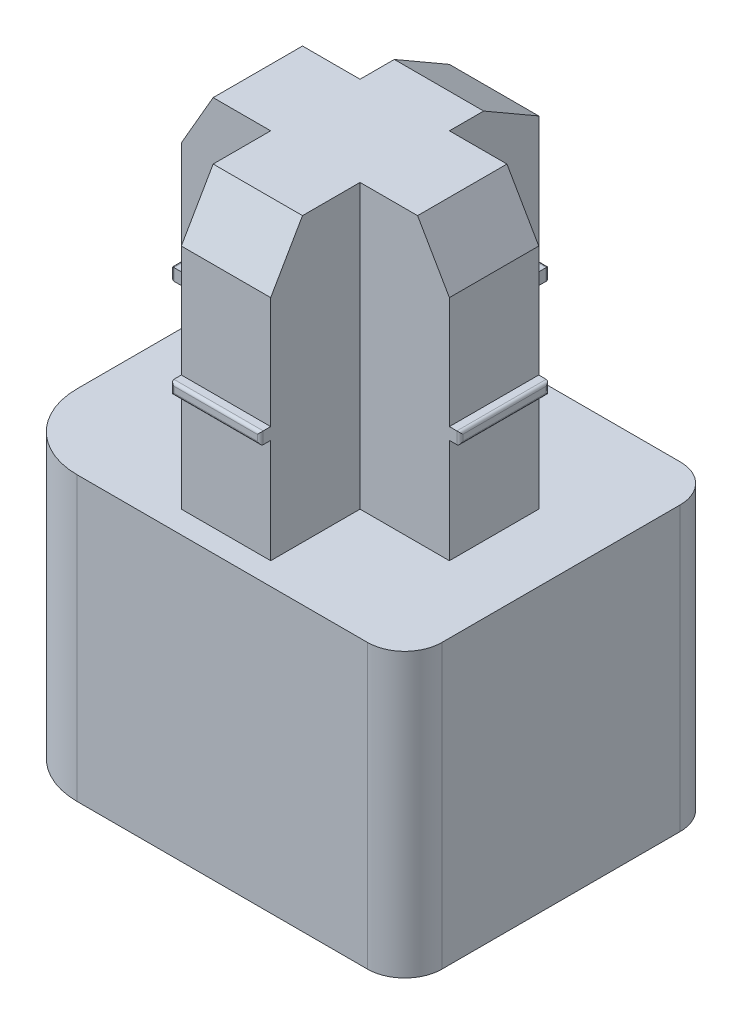
from build123d import *
from OCP.BRepFilletAPI import BRepFilletAPI_MakeChamfer

# Parameters (mm, degrees)
SKETCH1_W           = 6.858
SKETCH1_H           = 5.334
BOSS_EXTRUDE1_DEPTH = 4.826
SKETCH2_W           = 1.524
SKETCH2_H           = 1.524
BOSS_EXTRUDE2_DEPTH = 4.826
CHAMFER1_SIZE       = 0.9398
CHAMFER1_SIZE2      = 0.542593783
BOSS_EXTRUDE3_START = -3.048
SKETCH3_W           = 0.720393783
SKETCH3_H           = 1.524
SKETCH3_W_2         = 0.981406217
SKETCH3_W_3         = 1.524
SKETCH3_H_2         = 1.1176
SKETCH3_H_3         = 0.5842
SKETCH3_H_4         = 0.981406217
SKETCH3_H_5         = 0.720393783
BOSS_EXTRUDE3_DEPTH = 0.2032
FILLET2_R           = 0.0508
FILLET3_R           = 0.635
FILLET6_R           = 1.27
SKETCH4_W           = 3.2766
SKETCH4_H           = 3.2258
CUT_EXTRUDE1_DEPTH  = 2.032


with BuildPart() as part:
    # Sketch1 → Boss-Extrude1 (new body)
    with BuildSketch(Plane(origin=(0, 0, 0), x_dir=(1, 0, 0), z_dir=(0, 1, 0))):
        Rectangle(SKETCH1_W, SKETCH1_H)
    extrude(amount=BOSS_EXTRUDE1_DEPTH)

    # Sketch2 → Boss-Extrude2 (add)
    with BuildSketch(Plane(origin=(0, 4.826, 0), x_dir=(1, 0, 0), z_dir=(0, 1, 0))):
        Rectangle(SKETCH2_W, SKETCH2_H)
        with Locations((1.524, 0)):
            Rectangle(SKETCH2_W, SKETCH2_H)
        with Locations((0, 1.524)):
            Rectangle(SKETCH2_W, SKETCH2_H)
        with Locations((-1.524, 0)):
            Rectangle(SKETCH2_W, SKETCH2_H)
        with Locations((0, -1.524)):
            Rectangle(SKETCH2_W, SKETCH2_H)
    extrude(amount=BOSS_EXTRUDE2_DEPTH)

    # Chamfer1: one chamfer whose edges measure the first distance from different faces: ONE call of the kernel's chamfer builder (chamfer() names one face for all edges)
    chamfer1_edges_1 = [part.edges().sort_by_distance(p)[0] for p in [
        (2.286, 9.652, 0),
    ]]
    chamfer1_side_1 = [part.faces().sort_by_distance(p)[0] for p in [
        (2.286, 7.239, 0),
    ]]
    chamfer1_edges_2 = [part.edges().sort_by_distance(p)[0] for p in [
        (0, 9.652, -2.286),
    ]]
    chamfer1_side_2 = [part.faces().sort_by_distance(p)[0] for p in [
        (0, 9.652, 0),
    ]]
    chamfer1_edges_3 = [part.edges().sort_by_distance(p)[0] for p in [
        (-2.286, 9.652, 0),
    ]]
    chamfer1_side_3 = [part.faces().sort_by_distance(p)[0] for p in [
        (-2.286, 7.239, 0),
    ]]
    chamfer1_edges_4 = [part.edges().sort_by_distance(p)[0] for p in [
        (0, 9.652, 2.286),
    ]]
    chamfer1_side_4 = [part.faces().sort_by_distance(p)[0] for p in [
        (0, 7.239, 2.286),
    ]]
    chamfer1 = BRepFilletAPI_MakeChamfer(part.part.solid().wrapped)
    for e in chamfer1_edges_1:
        chamfer1.Add(CHAMFER1_SIZE, CHAMFER1_SIZE2, e.wrapped, chamfer1_side_1[0].wrapped)  # the first distance lies on this face
    for e in chamfer1_edges_2:
        chamfer1.Add(CHAMFER1_SIZE, CHAMFER1_SIZE2, e.wrapped, chamfer1_side_2[0].wrapped)  # the first distance lies on this face
    for e in chamfer1_edges_3:
        chamfer1.Add(CHAMFER1_SIZE, CHAMFER1_SIZE2, e.wrapped, chamfer1_side_3[0].wrapped)  # the first distance lies on this face
    for e in chamfer1_edges_4:
        chamfer1.Add(CHAMFER1_SIZE, CHAMFER1_SIZE2, e.wrapped, chamfer1_side_4[0].wrapped)  # the first distance lies on this face
    add(Compound.cast(chamfer1.Shape()), mode=Mode.REPLACE)

    # Sketch3 → Boss-Extrude3 (add)
    with BuildSketch(Plane(origin=(0, 9.652, 0), x_dir=(1, 0, 0), z_dir=(0, 1, 0)).offset(BOSS_EXTRUDE3_START)):
        with Locations((2.103603109, 0)):
            Rectangle(SKETCH3_W, SKETCH3_H)
        with Locations((1.252703108, 0)):
            Rectangle(SKETCH3_W_2, SKETCH3_H)
        with Locations((0, 1.905)):
            Rectangle(SKETCH3_W_3, SKETCH3_H_2)
        with Locations((0, 1.0541)):
            Rectangle(SKETCH3_W_3, SKETCH3_H_3)
        Rectangle(SKETCH3_W_3, SKETCH3_H)
        with Locations((-1.252703108, 0)):
            Rectangle(SKETCH3_W_2, SKETCH3_H)
        with Locations((-2.103603109, 0)):
            Rectangle(SKETCH3_W, SKETCH3_H)
        with Locations((0, -1.252703108)):
            Rectangle(SKETCH3_W_3, SKETCH3_H_4)
        with Locations((0, -2.103603109)):
            Rectangle(SKETCH3_W_3, SKETCH3_H_5)
    extrude(amount=BOSS_EXTRUDE3_DEPTH)

    # Fillet2
    fillet2_edges = [part.edges().sort_by_distance(p)[0] for p in [
        (-2.4638, 6.8072, 0),
        (0, 6.8072, 2.4638),
        (2.4638, 6.604, 0),
        (2.4638, 6.8072, 0),
        (2.4638, 6.7056, 0.762),
        (2.4638, 6.7056, -0.762),
        (0, 6.8072, -2.4638),
        (0.762, 6.7056, -2.4638),
        (-0.762, 6.7056, -2.4638),
        (-2.4638, 6.604, 0),
        (-2.4638, 6.7056, -0.762),
        (0, 6.604, 2.4638),
        (-0.762, 6.7056, 2.4638),
        (0, 6.604, -2.4638),
        (-2.4638, 6.7056, 0.762),
        (0.762, 6.7056, 2.4638),
    ]]
    fillet(fillet2_edges, radius=FILLET2_R)

    # Fillet3
    fillet3_edges = [part.edges().sort_by_distance(p)[0] for p in [
        (3.429, 2.413, 2.667),
        (-3.429, 2.413, -2.667),
        (3.429, 2.413, -2.667),
    ]]
    fillet(fillet3_edges, radius=FILLET3_R)

    # Fillet6
    fillet6_edges = [part.edges().sort_by_distance(p)[0] for p in [
        (-3.429, 2.413, 2.667),
    ]]
    fillet(fillet6_edges, radius=FILLET6_R)

    # Sketch4 → Cut-Extrude1 (cut)
    with BuildSketch(Plane.XZ):
        Rectangle(SKETCH4_W, SKETCH4_H)
    extrude(amount=-CUT_EXTRUDE1_DEPTH, mode=Mode.SUBTRACT)


solid = part.part
